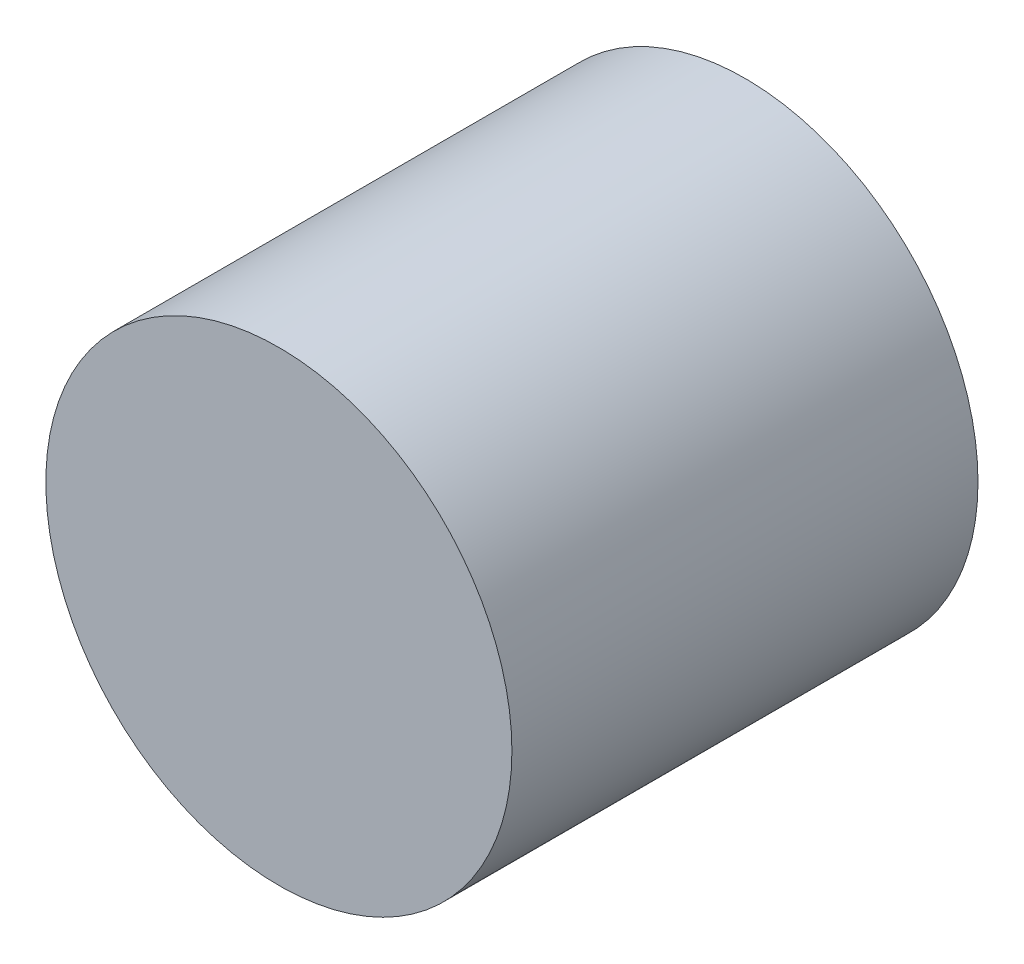
from build123d import *

# Parameters (mm, degrees)
SKETCH_1_R            = 10
EXTRUDE_1_DEPTH       = 20
F_2_5MM_1_D           = 2.5
F_2_5MM_1_DEPTH       = 10
F_2_5MM_1_CSINK_D     = 2.55
F_2_5MM_1_CSINK_ANGLE = 90
F_2_5MM_1_TIP         = 0.751075774


with BuildPart() as part:
    # 草图1 → 凸台-拉伸1 (new body)
    with BuildSketch(Plane.XY):
        Circle(SKETCH_1_R)
    extrude(amount=EXTRUDE_1_DEPTH)

    # Ø2.5mm 暗销孔1
    with Locations(Plane(origin=(0, 0, 0), x_dir=(-1, 0, 0), z_dir=(0, 0, -1))):
        with Locations((0, 0)):
            CounterSinkHole(F_2_5MM_1_D / 2, F_2_5MM_1_CSINK_D / 2, depth=F_2_5MM_1_DEPTH, counter_sink_angle=F_2_5MM_1_CSINK_ANGLE)
            with Locations((0, 0, -(F_2_5MM_1_DEPTH + F_2_5MM_1_TIP / 2))):  # 118° drill point
                Cone(0, F_2_5MM_1_D / 2, F_2_5MM_1_TIP, mode=Mode.SUBTRACT)


solid = part.part
